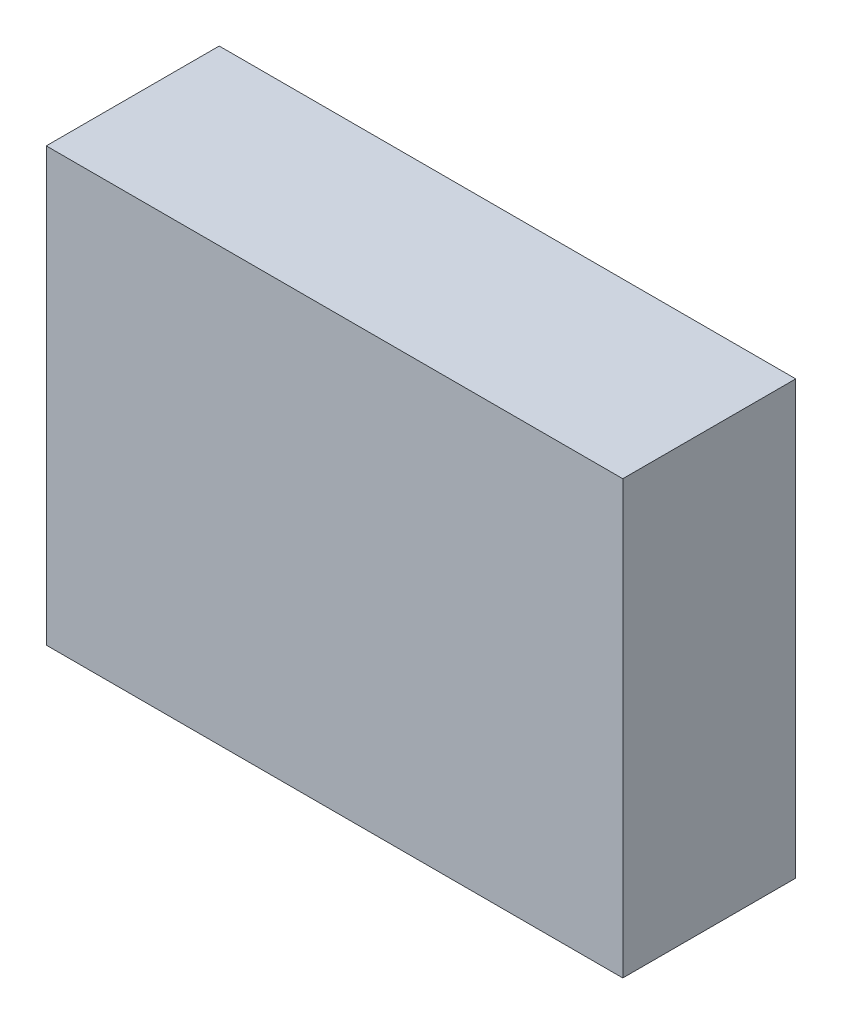
from build123d import *

# Parameters (mm, degrees)
SKETCH_1_W      = 40
SKETCH_1_H      = 30
EXTRUDE_1_DEPTH = 12


with BuildPart() as part:
    # 草图1 → 凸台-拉伸1 (new body)
    with BuildSketch(Plane.XY):
        Rectangle(SKETCH_1_W, SKETCH_1_H)
    extrude(amount=EXTRUDE_1_DEPTH)


solid = part.part
